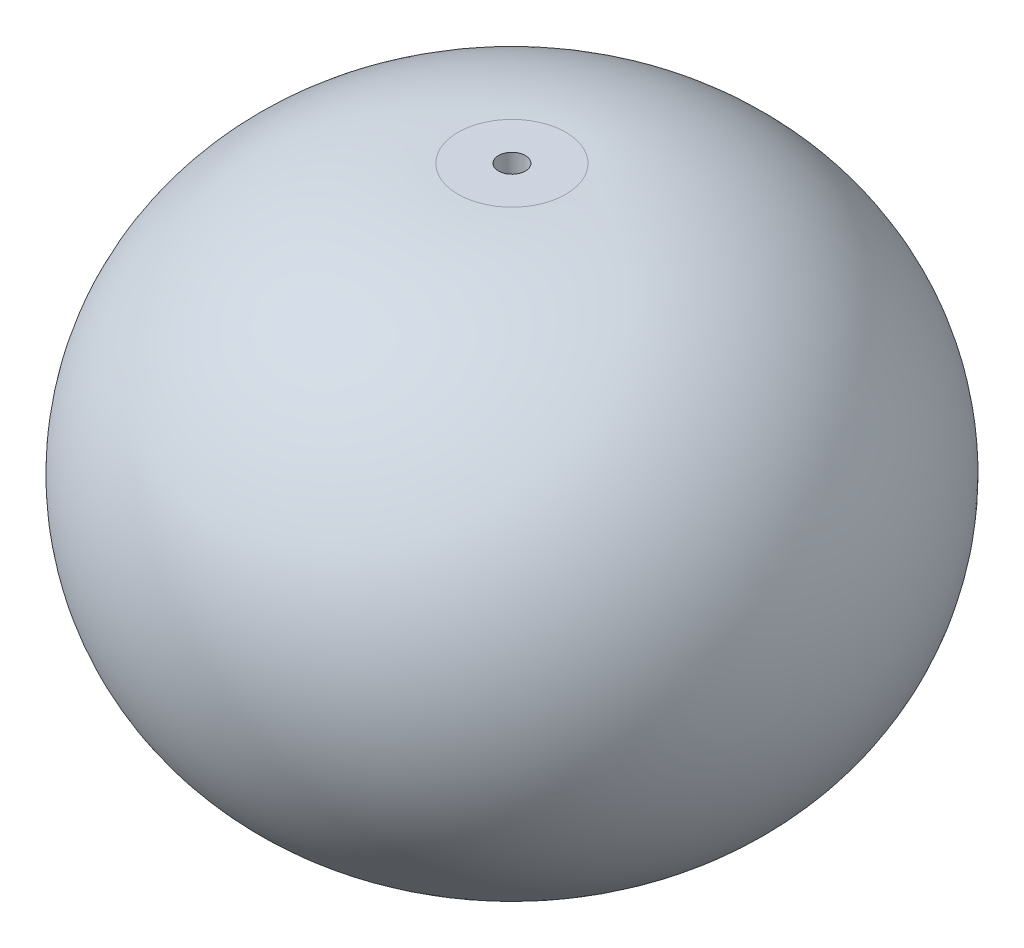
from build123d import *

# Parameters (mm, degrees)
SKETCH5_R          = 6.985
CUT_EXTRUDE1_DEPTH = 38.1
SKETCH6_R          = 2.54
CUT_EXTRUDE2_DEPTH = 38.1


with BuildPart() as part:
    # Sketch4 → Revolve1 (revolve)
    with BuildSketch(Plane.XY):
        with BuildLine():
            Line((0, 0), (62.23, 0))
            add(Edge.make_bspline(
                [(62.23, 0), (62.23, 50.8), (10.16, 50.8)],
                knots=[3.141592654, 3.141592654, 3.141592654, 4.71238898, 4.71238898, 4.71238898], degree=2, weights=[1, 0.707106781, 1]))
            Line((10.16, 50.8), (0, 50.8))
            Line((0, 50.8), (0, 0))
        make_face()
    revolve1 = revolve(axis=Axis((0, 0, 0), (0, 1, 0)))

    # Sketch5 → Cut-Extrude1 (cut)
    with BuildSketch(Plane.XZ):
        Circle(SKETCH5_R)
    cut_extrude1 = extrude(amount=-CUT_EXTRUDE1_DEPTH, mode=Mode.SUBTRACT)

    # Sketch6 → Cut-Extrude2 (cut)
    with BuildSketch(Plane.XZ.offset(-38.1)):
        Circle(SKETCH6_R)
    cut_extrude2 = extrude(amount=-CUT_EXTRUDE2_DEPTH, mode=Mode.SUBTRACT)


with BuildPart() as mirror1_1:
    # Mirror1: Revolve1 across Top Plane
    add(revolve1.mirror(Plane(origin=(0, 0, 0), x_dir=(1, 0, 0), z_dir=(0, 1, 0))))

    # Mirror1 2: Cut-Extrude1, Cut-Extrude2 across Top Plane
    add(cut_extrude1.mirror(Plane(origin=(0, 0, 0), x_dir=(1, 0, 0), z_dir=(0, 1, 0))), mode=Mode.SUBTRACT)
    add(cut_extrude2.mirror(Plane(origin=(0, 0, 0), x_dir=(1, 0, 0), z_dir=(0, 1, 0))), mode=Mode.SUBTRACT)


with BuildPart() as part_1:
    add(part.part)

    # Mirror1 united with what the copies touc: union Mirror1_1
    add(mirror1_1.part)


solid = part_1.part
